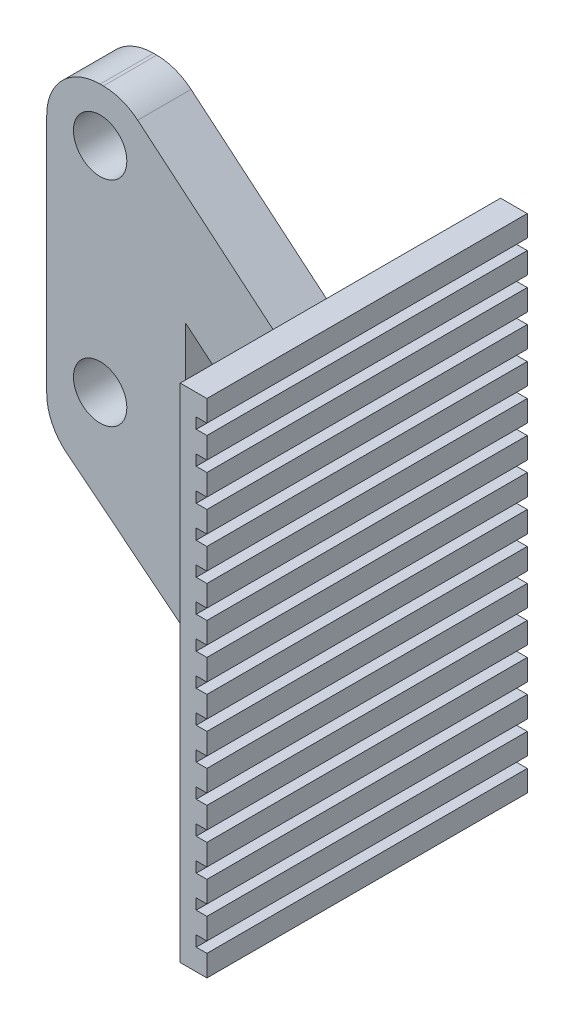
from build123d import *

# Parameters (mm, degrees)
SKETCH2_W           = 10
SKETCH2_H           = 30
SKETCH2_R           = 2.5
BOSS_EXTRUDE1_DEPTH = 5
SKETCH3_W           = 30
SKETCH3_H           = 30
BOSS_EXTRUDE2_DEPTH = 2
SKETCH4_W           = 2
SKETCH4_H           = 30
BOSS_EXTRUDE3_DEPTH = 20
SKETCH5_W           = 30
SKETCH5_H           = 50
BOSS_EXTRUDE4_DEPTH = 18.5
CUT_EXTRUDE1_DEPTH  = 15
BOSS_EXTRUDE5_DEPTH = 5
SKETCH9_W           = 30
SKETCH9_H           = 50
CUT_EXTRUDE2_DEPTH  = 3
CUT_EXTRUDE3_DEPTH  = 10
FILLET1_R           = 5
SKETCH13_W          = 2.5
SKETCH13_H          = 30
CUT_EXTRUDE4_DEPTH  = 8
BOSS_EXTRUDE9_DEPTH = 5
SKETCH15_W          = 30
SKETCH15_H          = 1
CUT_EXTRUDE5_DEPTH  = 1
CUT_EXTRUDE6_DEPTH  = 50.117206761


with BuildPart() as part:
    # Sketch2 → Boss-Extrude1 (new body)
    with BuildSketch(Plane.XY):
        Rectangle(SKETCH2_W, SKETCH2_H)
        with Locations((0, 10)):
            Circle(SKETCH2_R, mode=Mode.SUBTRACT)
        with Locations((0, -10)):
            Circle(SKETCH2_R, mode=Mode.SUBTRACT)
    extrude(amount=BOSS_EXTRUDE1_DEPTH)

    # Sketch3 → Boss-Extrude2 (add)
    with BuildSketch(Plane(origin=(5, 0, 0), x_dir=(0, 0, -1), z_dir=(1, 0, 0))):
        with Locations((-2.5, 0)):
            Rectangle(SKETCH3_W, SKETCH3_H)
    extrude(amount=BOSS_EXTRUDE2_DEPTH)

    # Sketch4 → Boss-Extrude3 (add)
    with BuildSketch(Plane.XZ.offset(15)):
        with Locations((6, 2.5)):
            Rectangle(SKETCH4_W, SKETCH4_H)
    extrude(amount=BOSS_EXTRUDE3_DEPTH)

    # Sketch5 → Boss-Extrude4 (add)
    with BuildSketch(Plane(origin=(7, 0, 0), x_dir=(0, 0, -1), z_dir=(1, 0, 0))):
        with Locations((-2.5, -10)):
            Rectangle(SKETCH5_W, SKETCH5_H)
    extrude(amount=BOSS_EXTRUDE4_DEPTH)

    # Sketch6 → Cut-Extrude1 (cut)
    with BuildSketch(Plane.ZY.offset(-5)):
        Polygon((-12.5, 15), (-12.5, -35), (17.5, -35), (17.5, 15), (5, 15), (5, -15), (0, -15), (0, 15), align=None)
    extrude(amount=-CUT_EXTRUDE1_DEPTH, mode=Mode.SUBTRACT)

    # Sketch7 → Boss-Extrude5 (add)
    with BuildSketch(Plane.XY):
        Polygon((-5, -15), (20, -35), (20, -15), align=None)
    extrude(amount=BOSS_EXTRUDE5_DEPTH)

    # Sketch9 → Cut-Extrude2 (cut)
    with BuildSketch(Plane(origin=(25.5, 0, 0), x_dir=(0, 0, -1), z_dir=(1, 0, 0))):
        with Locations((-2.5, -10)):
            Rectangle(SKETCH9_W, SKETCH9_H)
    extrude(amount=-CUT_EXTRUDE2_DEPTH, mode=Mode.SUBTRACT)

    # Sketch12 → Cut-Extrude3 (cut)
    with BuildSketch(Plane.XY.offset(5)):
        Polygon((2.123696111, 15), (20, 0), (20, 15), align=None)
    extrude(amount=-CUT_EXTRUDE3_DEPTH, mode=Mode.SUBTRACT)

    # Fillet1
    fillet1_edges = [part.edges().sort_by_distance(p)[0] for p in [
        (2.123696111, 15, 2.5),
        (-5, -15, 2.5),
        (-5, 15, 2.5),
    ]]
    fillet(fillet1_edges, radius=FILLET1_R)

    # Sketch13 → Cut-Extrude4 (cut)
    with BuildSketch(Plane(origin=(0, 15, 0), x_dir=(1, 0, 0), z_dir=(0, 1, 0))):
        with Locations((21.25, -2.5)):
            Rectangle(SKETCH13_W, SKETCH13_H)
    extrude(amount=-CUT_EXTRUDE4_DEPTH, mode=Mode.SUBTRACT)

    # Sketch14 → Boss-Extrude9 (add)
    with BuildSketch(Plane.XZ.offset(35)):
        Polygon((22.5, -12.5), (22.5, 17.5), (20, 17.5), (20, 5), (20, 0), (20, -12.5), align=None)
    extrude(amount=BOSS_EXTRUDE9_DEPTH)

    # Sketch15 → Cut-Extrude5 (cut)
    with BuildSketch(Plane(origin=(22.5, 0, 0), x_dir=(0, 0, -1), z_dir=(1, 0, 0))):
        with Locations((-2.5, 4.5)):
            Rectangle(SKETCH15_W, SKETCH15_H)
        with Locations((-2.5, 1.5)):
            Rectangle(SKETCH15_W, SKETCH15_H)
        with Locations((-2.5, -1.5)):
            Rectangle(SKETCH15_W, SKETCH15_H)
        with Locations((-2.5, -4.5)):
            Rectangle(SKETCH15_W, SKETCH15_H)
        with Locations((-2.5, -7.5)):
            Rectangle(SKETCH15_W, SKETCH15_H)
        with Locations((-2.5, -10.5)):
            Rectangle(SKETCH15_W, SKETCH15_H)
        with Locations((-2.5, -13.5)):
            Rectangle(SKETCH15_W, SKETCH15_H)
        with Locations((-2.5, -16.5)):
            Rectangle(SKETCH15_W, SKETCH15_H)
        with Locations((-2.5, -19.5)):
            Rectangle(SKETCH15_W, SKETCH15_H)
        with Locations((-2.5, -22.5)):
            Rectangle(SKETCH15_W, SKETCH15_H)
        with Locations((-2.5, -25.5)):
            Rectangle(SKETCH15_W, SKETCH15_H)
        with Locations((-2.5, -28.5)):
            Rectangle(SKETCH15_W, SKETCH15_H)
        with Locations((-2.5, -31.5)):
            Rectangle(SKETCH15_W, SKETCH15_H)
        with Locations((-2.5, -34.5)):
            Rectangle(SKETCH15_W, SKETCH15_H)
        with Locations((-2.5, -37.5)):
            Rectangle(SKETCH15_W, SKETCH15_H)
    extrude(amount=-CUT_EXTRUDE5_DEPTH, mode=Mode.SUBTRACT)

    # Sketch17 → Cut-Extrude6 (cut, through all)
    with BuildSketch(Plane.XY.offset(5)):
        Polygon((8, -0.374062741), (8, -15.15500122), (16, -21.55500122), (16, -7.08685979), align=None)
    extrude(amount=-CUT_EXTRUDE6_DEPTH, mode=Mode.SUBTRACT)


solid = part.part
